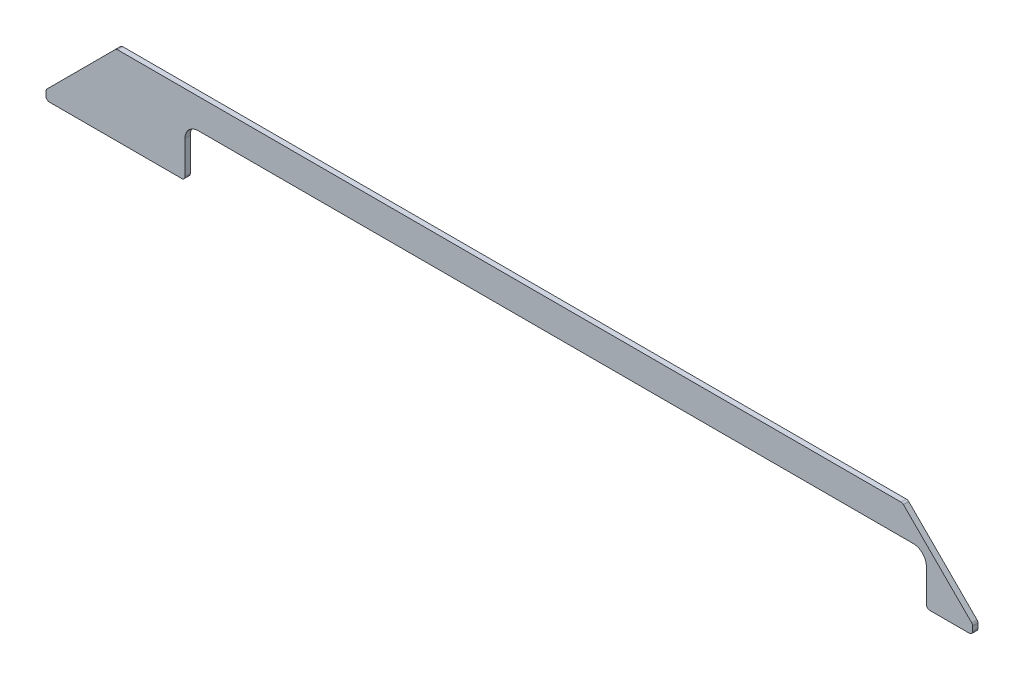
from build123d import *

# Parameters (mm, degrees)
BOSS_EXTRUDE1_DEPTH = 1.6
FILLET1_R           = 1


with BuildPart() as part:
    # Sketch1 → Boss-Extrude1 (new body)
    with BuildSketch(Plane.XY):
        with BuildLine():
            Line((21.213203436, 24), (0, 2.786796564))
            Line((0, 2.786796564), (0, 0))
            Line((0, 0), (42, 0))
            Line((42, 0), (42, 11))
            ThreePointArc((42, 11), (43.171572875, 13.828427125), (46, 15))
            Line((46, 15), (262, 15))
            ThreePointArc((262, 15), (264.828427125, 13.828427125), (266, 11))
            Line((266, 11), (266, 0))
            Line((266, 0), (280, 0))
            Line((280, 0), (280, 2.786796564))
            Line((280, 2.786796564), (258.786796564, 24))
            Line((258.786796564, 24), (21.213203436, 24))
        make_face()
    extrude(amount=BOSS_EXTRUDE1_DEPTH)

    # Fillet1
    fillet1_edges = [part.edges().sort_by_distance(p)[0] for p in [
        (42, 0, 0.8),
        (0, 0, 0.8),
        (0, 2.786796564, 0.8),
        (21.213203436, 24, 0.8),
        (258.786796564, 24, 0.8),
        (280, 2.786796564, 0.8),
        (280, 0, 0.8),
        (266, 0, 0.8),
    ]]
    fillet(fillet1_edges, radius=FILLET1_R)


solid = part.part
